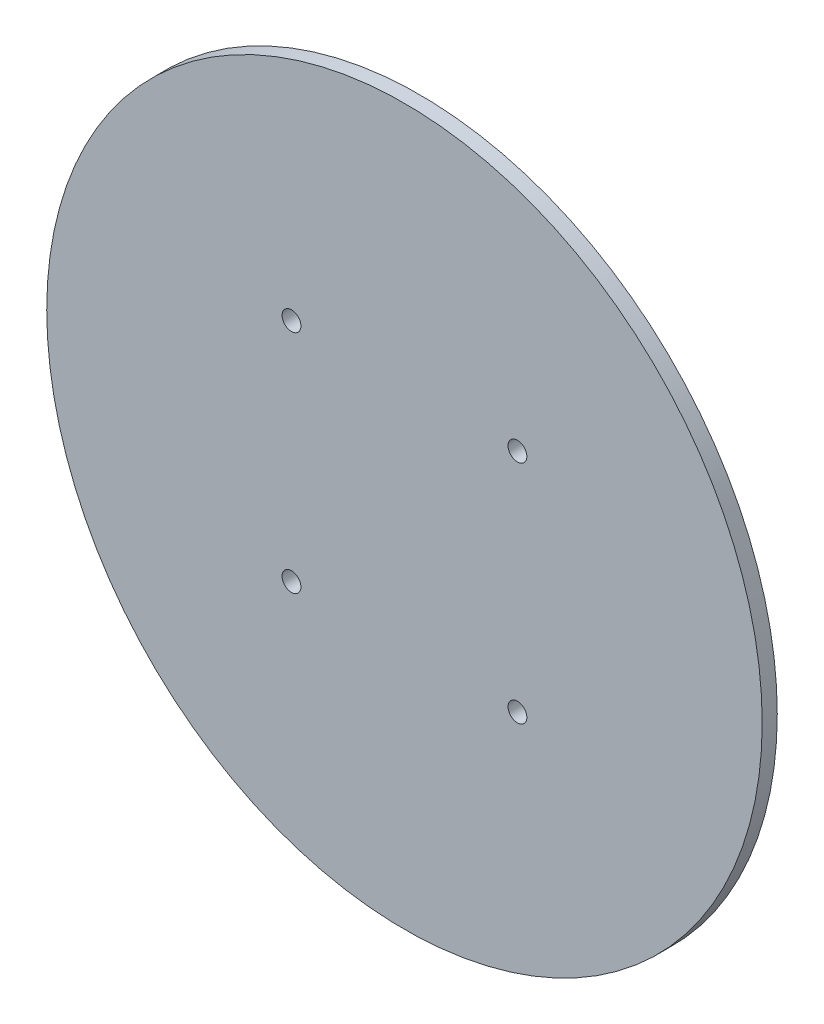
from build123d import *

# Parameters (mm, degrees)
CROQUIS1_R              = 95
SALIENTE_EXTRUIR1_DEPTH = 4
CROQUIS2_R              = 2.5
CORTAR_EXTRUIR1_DEPTH   = 4


with BuildPart() as part:
    # Croquis1 → Saliente-Extruir1 (new body)
    with BuildSketch(Plane.XY):
        Circle(CROQUIS1_R)
    extrude(amount=SALIENTE_EXTRUIR1_DEPTH)

    # Croquis2 → Cortar-Extruir1 (cut)
    with BuildSketch(Plane.XY.offset(4)):
        with Locations((-30, 30)):
            Circle(CROQUIS2_R)
        with Locations((30, 30)):
            Circle(CROQUIS2_R)
        with Locations((-30, -30)):
            Circle(CROQUIS2_R)
        with Locations((30, -30)):
            Circle(CROQUIS2_R)
    extrude(amount=-CORTAR_EXTRUIR1_DEPTH, mode=Mode.SUBTRACT)


solid = part.part
